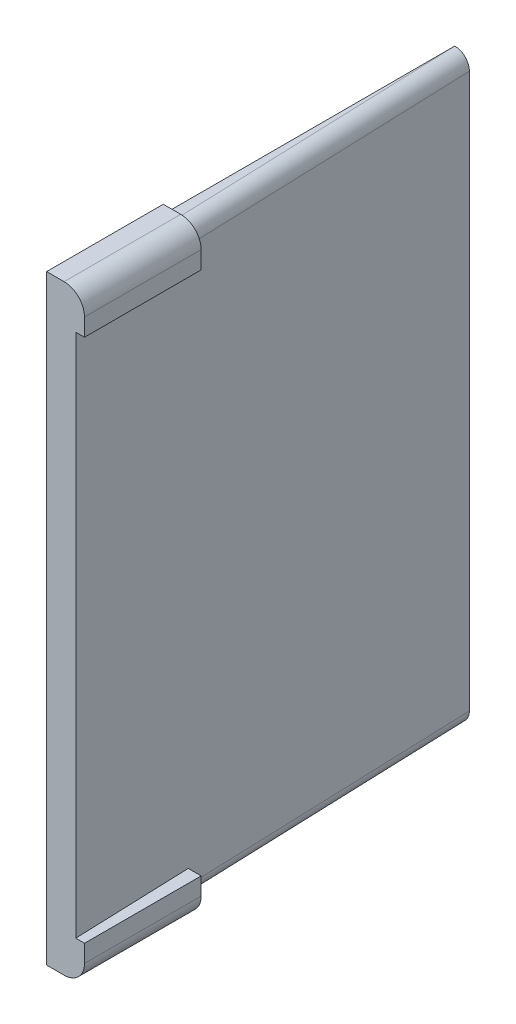
from build123d import *

# Parameters (mm, degrees)
SALIENTE_EXTRUIR1_DEPTH = 200
CROQUIS5_W              = 40
CROQUIS5_H              = 13
SALIENTE_EXTRUIR4_DEPTH = 13
REDONDEO9_R             = 7
REDONDEO11_R            = 5


with BuildPart() as part:
    # Croquis1 → Saliente-Extruir1 (new body)
    with BuildSketch(Plane(origin=(0, 0, 0), x_dir=(1, 0, 0), z_dir=(0, 1, 0))):
        Polygon((5, 140), (10, 0), (5, 0), (0, 0), (0, 140), align=None)
    extrude(amount=SALIENTE_EXTRUIR1_DEPTH)

    # Croquis5 → Saliente-Extruir4 (add)
    with BuildSketch(Plane.ZY):
        with Locations((-20, 196.5)):
            Rectangle(CROQUIS5_W, CROQUIS5_H)
        with Locations((-20, 3.5)):
            Rectangle(CROQUIS5_W, CROQUIS5_H)
    extrude(amount=-SALIENTE_EXTRUIR4_DEPTH)

    # Redondeo9
    redondeo9_edges = [part.edges().sort_by_distance(p)[0] for p in [
        (13, 203, -20),
        (13, -3, -20),
    ]]
    fillet(redondeo9_edges, radius=REDONDEO9_R)

    # Redondeo11
    redondeo11_edges = [part.edges().sort_by_distance(p)[0] for p in [
        (6.785714286, 0, -90),
        (6.785714286, 200, -90),
    ]]
    fillet(redondeo11_edges, radius=REDONDEO11_R)


solid = part.part
